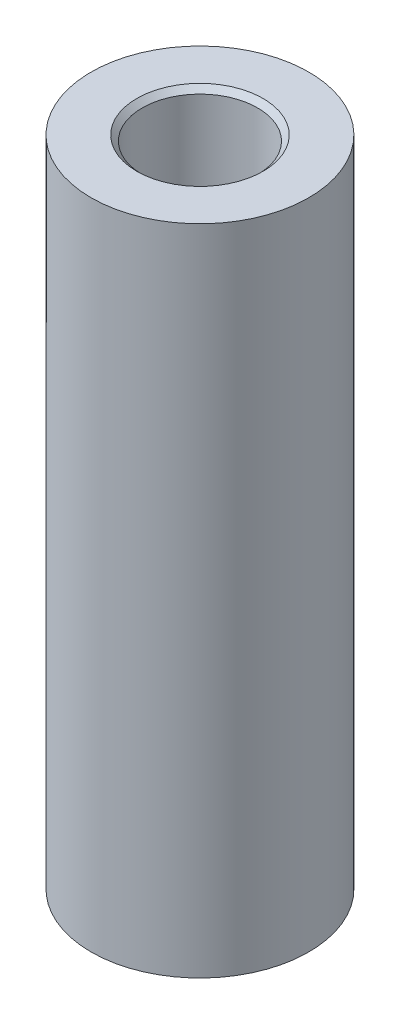
from build123d import *

# Parameters (mm, degrees)
SKETCH1_R            = 5
BOSS_EXTRUDE1_DEPTH  = 15
M5_CLEARANCE_HOLE1_D = 5.3
CHAMFER1_SIZE        = 0.25


with BuildPart() as part:
    # Sketch1 → Boss-Extrude1 (new, symmetric)
    with BuildSketch(Plane(origin=(0, 0, 0), x_dir=(1, 0, 0), z_dir=(0, 1, 0))):
        with Locations(Location((0, 0, 0), (0, 0, 270))):
            Circle(SKETCH1_R)
    extrude(amount=BOSS_EXTRUDE1_DEPTH, both=True)

    # M5 Clearance Hole1 (through all)
    with Locations(Plane(origin=(0, 15, 0), x_dir=(1, 0, 0), z_dir=(0, 1, 0))):
        with Locations((0, 0)):
            Hole(M5_CLEARANCE_HOLE1_D / 2)

    # Chamfer1
    chamfer1_edges = [part.edges().sort_by_distance(p)[0] for p in [
        (2.65, 15, 0),
        (2.65, -15, 0),
    ]]
    chamfer(chamfer1_edges, length=CHAMFER1_SIZE)


solid = part.part
